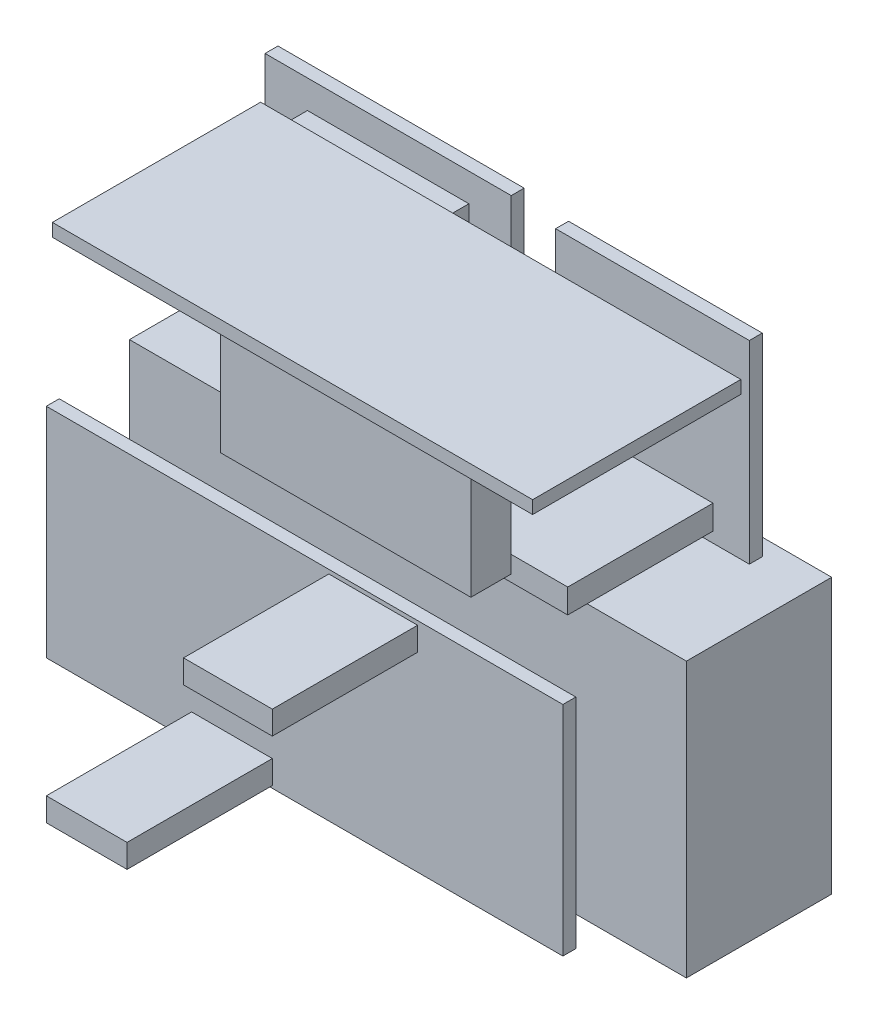
from build123d import *

# Parameters (mm, degrees)
AA_START                                   = 2.8
AA_HOLDER_69_X_34_X_18_PROFILE_W           = 69
AA_HOLDER_69_X_34_X_18_PROFILE_H           = 34
AA_HOLDER_69_X_34_X_18_DEPTH               = 18
YBX_START                                  = 6.4
YBX_BOARD_24_X_24_PROFILE_W                = 24
YBX_BOARD_24_X_24_PROFILE_H                = 24
YBX_BOARD_24_X_24_DEPTH                    = 1.6
YBX_START_2                                = 8
YBX_JUMPER_ENVELOPE_PROFILE_W              = 15
YBX_JUMPER_ENVELOPE_PROFILE_H              = 3
YBX_JUMPER_ENVELOPE_DEPTH                  = 18
GNSS_START                                 = 6.4
GNSS_BOARD_30_5_X_25_5_PROFILE_W           = 30.5
GNSS_BOARD_30_5_X_25_5_PROFILE_H           = 25.5
GNSS_BOARD_30_5_X_25_5_DEPTH               = 1.6
GNSS_START_2                               = 8
GNSS_PATCH_ALLOWANCE_ONLY_PROFILE_W        = 20
GNSS_PATCH_ALLOWANCE_ONLY_PROFILE_H        = 16
GNSS_PATCH_ALLOWANCE_ONLY_DEPTH            = 4
POWER_START                                = 10.3
POWER_BOARD_59_5_X_25_8_PROFILE_W          = 59.5
POWER_BOARD_59_5_X_25_8_PROFILE_H          = 1.6
POWER_BOARD_59_5_X_25_8_DEPTH              = 25.8
POWER_START_2                              = 27
POWER_HORIZONTAL_CONNECTOR_ENVELOPE_PROF_W = 31
POWER_HORIZONTAL_CONNECTOR_ENVELOPE_PROF_H = 16.8
POWER_HORIZONTAL_CONNECTOR_ENVELOPE_DEPTH  = 5
EORA_START                                 = 33
EORA_BOARD_64_X_27_PROFILE_W               = 64
EORA_BOARD_64_X_27_PROFILE_H               = 27
EORA_BOARD_64_X_27_DEPTH                   = 1.6
EORA_START_2                               = 34.6
EORA_UPPER_CONNECTOR_ENVELOPE_A_PROFILE_W  = 10
EORA_UPPER_CONNECTOR_ENVELOPE_A_PROFILE_H  = 2.9
EORA_UPPER_CONNECTOR_ENVELOPE_A_DEPTH      = 18
EORA_UPPER_CONNECTOR_ENVELOPE_B_PROFILE_W  = 11
EORA_UPPER_CONNECTOR_ENVELOPE_B_PROFILE_H  = 2.9
EORA_UPPER_CONNECTOR_ENVELOPE_B_DEPTH      = 18


with BuildPart() as part:
    # AA holder 69 x 34 x 18 profile → AA holder 69 x 34 x 18 (new body)
    with BuildSketch(Plane.XY.offset(AA_START)):
        with Locations((-1, -12)):
            Rectangle(AA_HOLDER_69_X_34_X_18_PROFILE_W, AA_HOLDER_69_X_34_X_18_PROFILE_H)
    extrude(amount=AA_HOLDER_69_X_34_X_18_DEPTH)


with BuildPart() as body_2:
    # YBX board 24 x 24 profile → YBX board 24 x 24 (new body)
    with BuildSketch(Plane.XY.offset(YBX_START)):
        with Locations((16.5, 18.5)):
            Rectangle(YBX_BOARD_24_X_24_PROFILE_W, YBX_BOARD_24_X_24_PROFILE_H)
    extrude(amount=YBX_BOARD_24_X_24_DEPTH)


with BuildPart() as body_3:
    # YBX jumper envelope profile → YBX jumper envelope (new body)
    with BuildSketch(Plane.XY.offset(YBX_START_2)):
        with Locations((16.5, 9.3)):
            Rectangle(YBX_JUMPER_ENVELOPE_PROFILE_W, YBX_JUMPER_ENVELOPE_PROFILE_H)
    extrude(amount=YBX_JUMPER_ENVELOPE_DEPTH)


with BuildPart() as body_4:
    # GNSS board 30.5 x 25.5 profile → GNSS board 30.5 x 25.5 (new body)
    with BuildSketch(Plane.XY.offset(GNSS_START)):
        with Locations((-16.25, 18.55)):
            Rectangle(GNSS_BOARD_30_5_X_25_5_PROFILE_W, GNSS_BOARD_30_5_X_25_5_PROFILE_H)
    extrude(amount=GNSS_BOARD_30_5_X_25_5_DEPTH)


with BuildPart() as body_5:
    # GNSS patch allowance only profile → GNSS patch allowance only (new body)
    with BuildSketch(Plane.XY.offset(GNSS_START_2)):
        with Locations((-16.25, 19.8)):
            Rectangle(GNSS_PATCH_ALLOWANCE_ONLY_PROFILE_W, GNSS_PATCH_ALLOWANCE_ONLY_PROFILE_H)
    extrude(amount=GNSS_PATCH_ALLOWANCE_ONLY_DEPTH)


with BuildPart() as body_6:
    # Power board 59.5 x 25.8 profile → Power board 59.5 x 25.8 (new body)
    with BuildSketch(Plane.XY.offset(POWER_START)):
        with Locations((0, 27.3)):
            Rectangle(POWER_BOARD_59_5_X_25_8_PROFILE_W, POWER_BOARD_59_5_X_25_8_PROFILE_H)
    extrude(amount=POWER_BOARD_59_5_X_25_8_DEPTH)


with BuildPart() as body_7:
    # Power horizontal connector envelope profile → Power horizontal connector envelope (new body)
    with BuildSketch(Plane.XY.offset(POWER_START_2)):
        with Locations((2.5, 18.1)):
            Rectangle(POWER_HORIZONTAL_CONNECTOR_ENVELOPE_PROF_W, POWER_HORIZONTAL_CONNECTOR_ENVELOPE_PROF_H)
    extrude(amount=POWER_HORIZONTAL_CONNECTOR_ENVELOPE_DEPTH)


with BuildPart() as body_8:
    # EoRa board 64 x 27 profile → EoRa board 64 x 27 (new body)
    with BuildSketch(Plane.XY.offset(EORA_START)):
        with Locations((0, -7)):
            Rectangle(EORA_BOARD_64_X_27_PROFILE_W, EORA_BOARD_64_X_27_PROFILE_H)
    extrude(amount=EORA_BOARD_64_X_27_DEPTH)


with BuildPart() as body_9:
    # EoRa upper connector envelope A profile → EoRa upper connector envelope A (new body)
    with BuildSketch(Plane.XY.offset(EORA_START_2)):
        with Locations((-9, -18.75)):
            Rectangle(EORA_UPPER_CONNECTOR_ENVELOPE_A_PROFILE_W, EORA_UPPER_CONNECTOR_ENVELOPE_A_PROFILE_H)
    extrude(amount=EORA_UPPER_CONNECTOR_ENVELOPE_A_DEPTH)


with BuildPart() as body_10:
    # EoRa upper connector envelope B profile → EoRa upper connector envelope B (new body)
    with BuildSketch(Plane.XY.offset(EORA_START_2)):
        with Locations((8.5, 4.55)):
            Rectangle(EORA_UPPER_CONNECTOR_ENVELOPE_B_PROFILE_W, EORA_UPPER_CONNECTOR_ENVELOPE_B_PROFILE_H)
    extrude(amount=EORA_UPPER_CONNECTOR_ENVELOPE_B_DEPTH)


solid = Compound([part.part, body_2.part, body_3.part, body_4.part, body_5.part, body_6.part, body_7.part, body_8.part, body_9.part, body_10.part])
